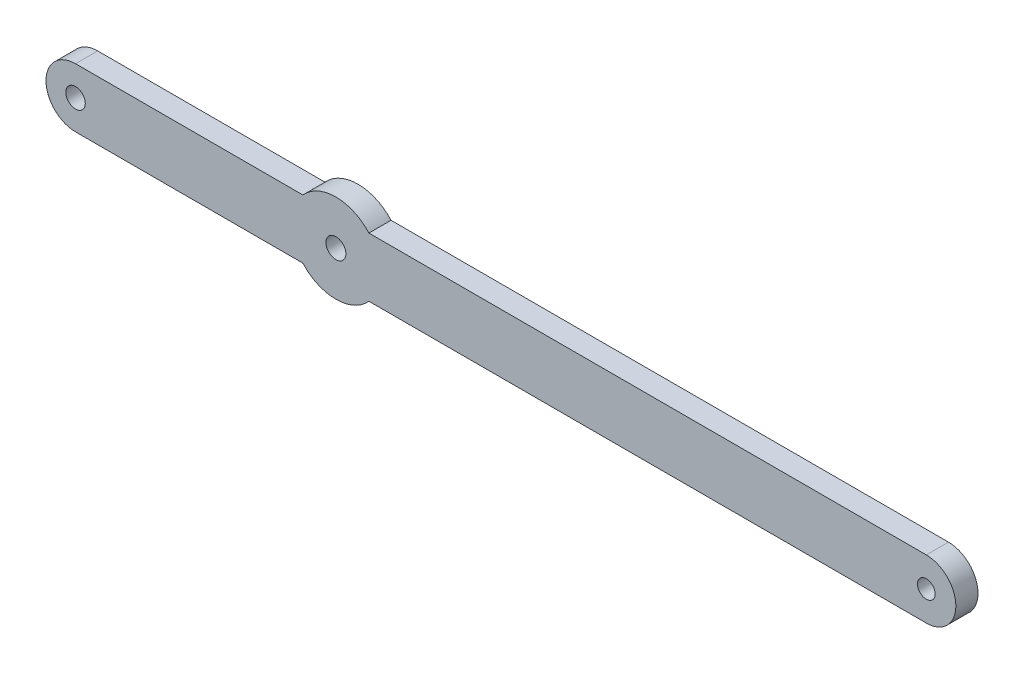
from build123d import *

# Parameters (mm, degrees)
SKETCH_1_R      = 1.2
SKETCH_1_R_2    = 1.35
SKETCH_1_R_3    = 1.32
EXTRUDE_1_DEPTH = 3


with BuildPart() as part:
    # 草图1 → 凸台-拉伸1 (new body)
    with BuildSketch(Plane(origin=(0, 0, 0), x_dir=(-1, 0, 0), z_dir=(0, 0, -1))):
        with BuildLine():
            Line((91.218663814, 7.514094575), (60.426417561, 7.514094575))
            ThreePointArc((60.426417561, 7.514094575), (55.954281606, 9.514094575), (51.482145651, 7.514094575))
            Line((51.482145651, 7.514094575), (-24.019834979, 7.514094575))
            ThreePointArc((-24.019834979, 7.514094575), (-28.019834979, 3.514094575), (-24.019834979, -0.485905425))
            Line((-24.019834979, -0.485905425), (51.482145651, -0.485905425))
            ThreePointArc((51.482145651, -0.485905425), (55.954281606, -2.485905425), (60.426417561, -0.485905425))
            Line((60.426417561, -0.485905425), (91.218663814, -0.485905425))
            ThreePointArc((91.218663814, -0.485905425), (95.218663814, 3.514094575), (91.218663814, 7.514094575))
        make_face()
        with Locations(Location((-24.020396654, 3.514094575, 0), (0, 0, 180))):
            Circle(SKETCH_1_R, mode=Mode.SUBTRACT)
        with Locations(Location((55.954281606, 3.514094575, 0), (0, 0, 180))):
            Circle(SKETCH_1_R_2, mode=Mode.SUBTRACT)
        with Locations(Location((91.218663814, 3.514094575, 0), (0, 0, 180))):
            Circle(SKETCH_1_R_3, mode=Mode.SUBTRACT)
    extrude(amount=-EXTRUDE_1_DEPTH)


solid = part.part
